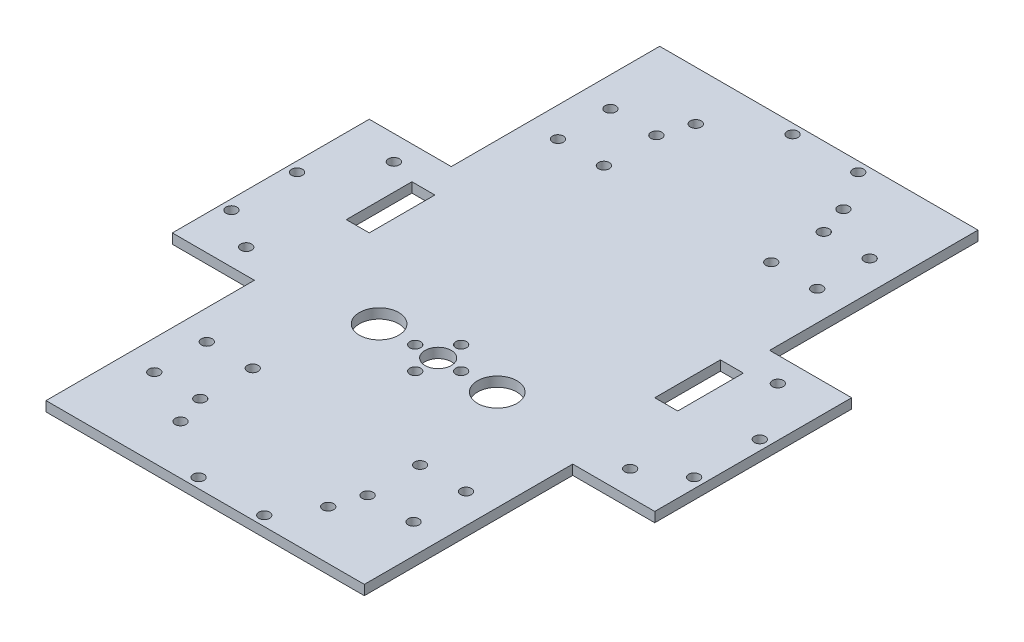
from build123d import *

# Parameters (mm, degrees)
SKETCH_1_W               = 97
SKETCH_1_H               = 187
EXTRUDE_1_DEPTH          = 3
SKETCH_2_R               = 1.65
CUT_EXTRUDE_1_DEPTH      = 3
SKETCH_3_R               = 4
SKETCH_3_R_2             = 1.65
CUT_EXTRUDE_2_DEPTH      = 3
SKETCH_3_4_R             = 1.65
CUT_EXTRUDE_3_DEPTH      = 3
PATTERN_CIRCULAR_1_COUNT = 4
SKETCH_4_W               = 25
SKETCH_4_H               = 60
EXTRUDE_2_DEPTH          = 3
SKETCH_6_R               = 1.65
CUT_EXTRUDE_5_DEPTH      = 3
CUT_EXTRUDE_8_REACH      = 120.968
SKETCH_9_R               = 6
SKETCH_24_R              = 1.65
CUT_EXTRUDE_15_DEPTH     = 3
SKETCH_33_R              = 1.65
CUT_EXTRUDE_24_DEPTH     = 3
SKETCH_42_R              = 1.65
CUT_EXTRUDE_32_DEPTH     = 3
SKETCH_44_W              = 7
SKETCH_44_H              = 20
CUT_EXTRUDE_34_DEPTH     = 10


with BuildPart() as part:
    # 草图1 → 凸台-拉伸1 (new body)
    with BuildSketch(Plane(origin=(0, 0, 0), x_dir=(1, 0, 0), z_dir=(0, 1, 0))):
        Rectangle(SKETCH_1_W, SKETCH_1_H)
    extrude(amount=EXTRUDE_1_DEPTH)

    # 草图2 → 切除-拉伸1 (cut)
    with BuildSketch(Plane(origin=(0, 3, 0), x_dir=(1, 0, 0), z_dir=(0, 1, 0))):
        with Locations(Location((39.5, -53.5, 0), (0, 0, 270))):
            Circle(SKETCH_2_R)
        with Locations(Location((25.5, -53.5, 0), (0, 0, 270))):
            Circle(SKETCH_2_R)
        with Locations(Location((25.5, -69.5, 0), (0, 0, 90))):
            Circle(SKETCH_2_R)
        with Locations(Location((39.5, -69.5, 0), (0, 0, 90))):
            Circle(SKETCH_2_R)
        with Locations(Location((-39.5, -69.5, 0), (0, 0, 270))):
            Circle(SKETCH_2_R)
        with Locations(Location((-25.5, -69.5, 0), (0, 0, 270))):
            Circle(SKETCH_2_R)
        with Locations(Location((-25.5, -53.5, 0), (0, 0, 90))):
            Circle(SKETCH_2_R)
        with Locations(Location((-39.5, -53.5, 0), (0, 0, 90))):
            Circle(SKETCH_2_R)
        with Locations(Location((-39.5, 53.5, 0), (0, 0, 270))):
            Circle(SKETCH_2_R)
        with Locations(Location((-25.5, 53.5, 0), (0, 0, 270))):
            Circle(SKETCH_2_R)
        with Locations(Location((-25.5, 69.5, 0), (0, 0, 90))):
            Circle(SKETCH_2_R)
        with Locations(Location((-39.5, 69.5, 0), (0, 0, 90))):
            Circle(SKETCH_2_R)
        with Locations(Location((39.5, 69.5, 0), (0, 0, 270))):
            Circle(SKETCH_2_R)
        with Locations(Location((25.5, 69.5, 0), (0, 0, 270))):
            Circle(SKETCH_2_R)
        with Locations(Location((25.5, 53.5, 0), (0, 0, 90))):
            Circle(SKETCH_2_R)
        with Locations(Location((39.5, 53.5, 0), (0, 0, 90))):
            Circle(SKETCH_2_R)
    extrude(amount=-CUT_EXTRUDE_1_DEPTH, mode=Mode.SUBTRACT)

    # 草图3 → 切除-拉伸2 (cut)
    with BuildSketch(Plane(origin=(0, 3, 0), x_dir=(1, 0, 0), z_dir=(0, 1, 0))):
        with Locations(Location((0, -22.5, 0), (0, 0, 270))):
            Circle(SKETCH_3_R)
        with Locations(Location((-18.5, -22.5, 0), (0, 0, 270))):
            Circle(SKETCH_3_R_2)
        with Locations(Location((18.5, -22.5, 0), (0, 0, 90))):
            Circle(SKETCH_3_R_2)
    extrude(amount=-CUT_EXTRUDE_2_DEPTH, mode=Mode.SUBTRACT)

    # 草图3<4> → 切除-拉伸3 (cut)
    with BuildSketch(Plane(origin=(0, 3, 0), x_dir=(1, 0, 0), z_dir=(0, 1, 0))):
        with Locations(Location((-7, -22.5, 0), (0, 0, 270))):
            Circle(SKETCH_3_4_R)
    cut_extrude_3 = extrude(amount=-CUT_EXTRUDE_3_DEPTH, mode=Mode.SUBTRACT)

    # 阵列(圆周)1: 切除-拉伸3 ×4 about axis
    pattern_circular_1_axis = Axis((0, 0, 22.5), (0, 1, 0))
    for i in range(1, PATTERN_CIRCULAR_1_COUNT):
        add(cut_extrude_3.rotate(pattern_circular_1_axis, i * 360 / PATTERN_CIRCULAR_1_COUNT), mode=Mode.SUBTRACT)

    # 草图4 → 凸台-拉伸2 (add)
    with BuildSketch(Plane(origin=(0, 3, 0), x_dir=(1, 0, 0), z_dir=(0, 1, 0))):
        with Locations((61, 0)):
            Rectangle(SKETCH_4_W, SKETCH_4_H)
    extrude_2 = extrude(amount=-EXTRUDE_2_DEPTH)

    # 镜向1: 凸台-拉伸2 across plane
    add(extrude_2.mirror(Plane(origin=(0, 0, 0), x_dir=(0, 0, 1), z_dir=(1, 0, 0))))

    # 草图6 → 切除-拉伸5 (cut)
    with BuildSketch(Plane.XZ):
        with Locations(Location((-5, 90.5, 0), (0, 0, 270))):
            Circle(SKETCH_6_R)
        with Locations(Location((15, 90.5, 0), (0, 0, 270))):
            Circle(SKETCH_6_R)
        with Locations(Location((-5, -90.5, 0), (0, 0, 270))):
            Circle(SKETCH_6_R)
        with Locations(Location((15, -90.5, 0), (0, 0, 270))):
            Circle(SKETCH_6_R)
    extrude(amount=-CUT_EXTRUDE_5_DEPTH, mode=Mode.SUBTRACT)

    # 草图9 → 切除-拉伸8 (cut, up to next)
    with BuildSketch(Plane(origin=(0, 3, 0), x_dir=(1, 0, 0), z_dir=(0, 1, 0)), mode=Mode.PRIVATE) as cut_extrude_8_sk1:
        with Locations(Location((-18, -22.5, 0), (0, 0, 270))):
            Circle(SKETCH_9_R)
    cut_extrude_8_tool1 = extrude(cut_extrude_8_sk1.sketch, amount=-CUT_EXTRUDE_8_REACH, mode=Mode.PRIVATE) & part.part
    # 草图9 → 切除-拉伸8 (cut, up to next)
    with BuildSketch(Plane(origin=(0, 3, 0), x_dir=(1, 0, 0), z_dir=(0, 1, 0)), mode=Mode.PRIVATE) as cut_extrude_8_sk2:
        with Locations(Location((18, -22.5, 0), (0, 0, 270))):
            Circle(SKETCH_9_R)
    cut_extrude_8_tool2 = extrude(cut_extrude_8_sk2.sketch, amount=-CUT_EXTRUDE_8_REACH, mode=Mode.PRIVATE) & part.part
    add(cut_extrude_8_tool1.solids().sort_by_distance((-18, 3, 22.5))[0], mode=Mode.SUBTRACT)
    add(cut_extrude_8_tool2.solids().sort_by_distance((18, 3, 22.5))[0], mode=Mode.SUBTRACT)

    # 草图24 → 切除-拉伸15 (cut)
    with BuildSketch(Plane(origin=(0, 3, 0), x_dir=(1, 0, 0), z_dir=(0, 1, 0))):
        with Locations(Location((-22.5, -78.5, 0), (0, 0, 270))):
            Circle(SKETCH_24_R)
        with Locations(Location((22.5, -78.5, 0), (0, 0, 270))):
            Circle(SKETCH_24_R)
        with Locations(Location((22.5, 78.5, 0), (0, 0, 270))):
            Circle(SKETCH_24_R)
        with Locations(Location((-22.5, 78.5, 0), (0, 0, 270))):
            Circle(SKETCH_24_R)
        with Locations((-100.151505846, -27.458044015)):
            Circle(SKETCH_24_R)
        with Locations((-95.406327774, 17.291070893)):
            Circle(SKETCH_24_R)
        with Locations(Location((58.5, -22.5, 0), (0, 0, 270))):
            Circle(SKETCH_24_R)
        with Locations(Location((58.5, 22.5, 0), (0, 0, 270))):
            Circle(SKETCH_24_R)
    extrude(amount=-CUT_EXTRUDE_15_DEPTH, mode=Mode.SUBTRACT)

    # 草图33 → 切除-拉伸24 (cut)
    with BuildSketch(Plane.XZ):
        with Locations(Location((70.5, -5, 0), (0, 0, 270))):
            Circle(SKETCH_33_R)
        with Locations(Location((70.5, 15, 0), (0, 0, 270))):
            Circle(SKETCH_33_R)
        with Locations(Location((-70.5, -5, 0), (0, 0, 270))):
            Circle(SKETCH_33_R)
        with Locations(Location((-70.5, 15, 0), (0, 0, 270))):
            Circle(SKETCH_33_R)
    extrude(amount=-CUT_EXTRUDE_24_DEPTH, mode=Mode.SUBTRACT)

    # 草图42 → 切除-拉伸32 (cut)
    with BuildSketch(Plane(origin=(0, 3, 0), x_dir=(1, 0, 0), z_dir=(0, 1, 0))):
        with Locations(Location((-58.5, 22.5, 0), (0, 0, 270))):
            Circle(SKETCH_42_R)
        with Locations(Location((-58.5, -22.5, 0), (0, 0, 270))):
            Circle(SKETCH_42_R)
    extrude(amount=-CUT_EXTRUDE_32_DEPTH, mode=Mode.SUBTRACT)

    # 草图44 → 切除-拉伸34 (cut)
    with BuildSketch(Plane(origin=(0, 3, 0), x_dir=(1, 0, 0), z_dir=(0, 1, 0))):
        with Locations((-47, 10)):
            Rectangle(SKETCH_44_W, SKETCH_44_H)
        with Locations((47, 10)):
            Rectangle(SKETCH_44_W, SKETCH_44_H)
    extrude(amount=-CUT_EXTRUDE_34_DEPTH, mode=Mode.SUBTRACT)


solid = part.part
